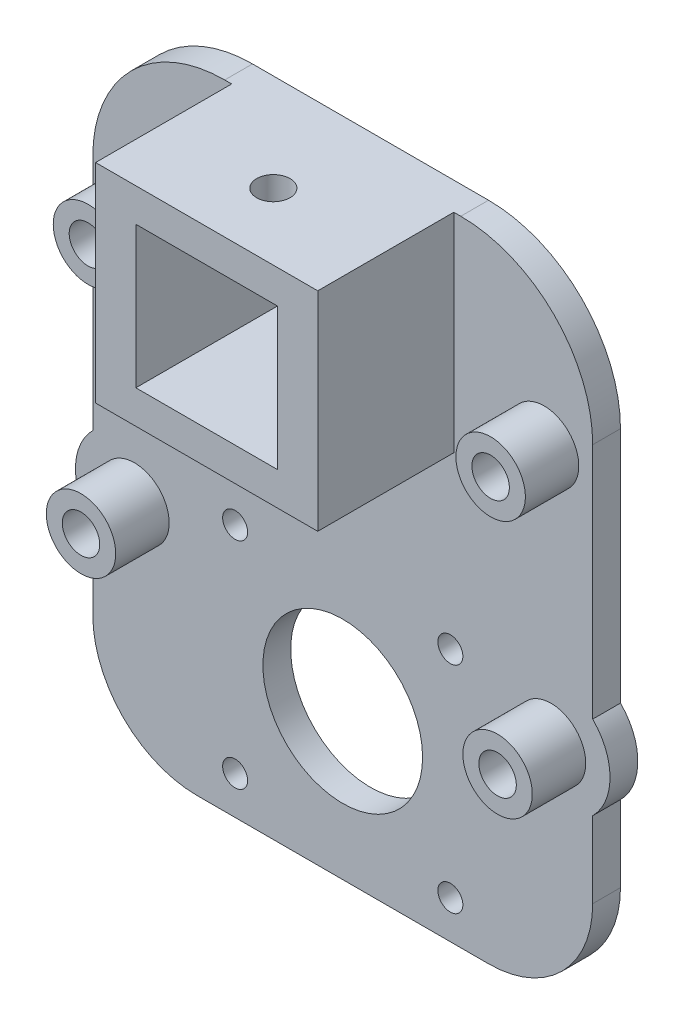
from build123d import *

# Parameters (mm, degrees)
SKETCH_1_R          = 1.8
SKETCH_1_R_2        = 11.5
SKETCH_1_R_3        = 2.7
SKETCH_1_W          = 20.4
SKETCH_1_H          = 20.4
EXTRUDE_1_DEPTH     = 4
EXTRUDE_START       = 4
SKETCH_1_4_W        = 32
SKETCH_1_4_H        = 30
SKETCH_1_4_W_2      = 20.4
SKETCH_1_4_H_2      = 20.4
SKETCH_1_4_R        = 1.6
EXTRUDE_3_DEPTH     = 19.6
CUT_EXTRUDE_4_REACH = 103.812
SKETCH_8_R          = 2.4
SKETCH_9_R          = 5
SKETCH_9_R_2        = 2.7
EXTRUDE_4_DEPTH     = 7.7


with BuildPart() as part:
    # 草图1 → 凸台-拉伸1 (new body)
    with BuildSketch(Plane.XY):
        with BuildLine():
            ThreePointArc((-36, -25.5), (-31.606601718, -36.106601718), (-21, -40.5))
            Line((-21, -40.5), (21, -40.5))
            ThreePointArc((21, -40.5), (31.606601718, -36.106601718), (36, -25.5))
            Line((36, -25.5), (36, -14.520797289))
            ThreePointArc((36, -14.520797289), (38.5, -8.5), (36, -2.479202711))
            Line((36, -2.479202711), (36, 31.75))
            ThreePointArc((36, 31.75), (30.435028843, 45.185028843), (17, 50.75))
            Line((17, 50.75), (-17, 50.75))
            ThreePointArc((-17, 50.75), (-30.435028843, 45.185028843), (-36, 31.75))
            Line((-36, 31.75), (-36, -2.479202711))
            ThreePointArc((-36, -2.479202711), (-38.5, -8.5), (-36, -14.520797289))
            Line((-36, -14.520797289), (-36, -25.5))
        make_face()
        with Locations((15.5, -35)):
            Circle(SKETCH_1_R, mode=Mode.SUBTRACT)
        with Locations((0, -19.5)):
            Circle(SKETCH_1_R_2, mode=Mode.SUBTRACT)
        with Locations((15.5, -4)):
            Circle(SKETCH_1_R, mode=Mode.SUBTRACT)
        with Locations((-15.5, -35)):
            Circle(SKETCH_1_R, mode=Mode.SUBTRACT)
        with Locations((-15.5, -4)):
            Circle(SKETCH_1_R, mode=Mode.SUBTRACT)
        with Locations((-30, -8.5)):
            Circle(SKETCH_1_R_3, mode=Mode.SUBTRACT)
        with Locations((30, -8.5)):
            Circle(SKETCH_1_R_3, mode=Mode.SUBTRACT)
        with Locations((-29, 28.1)):
            Circle(SKETCH_1_R_3, mode=Mode.SUBTRACT)
        with Locations((29, 28.1)):
            Circle(SKETCH_1_R_3, mode=Mode.SUBTRACT)
        with Locations((0, 35.75)):
            Rectangle(SKETCH_1_W, SKETCH_1_H, mode=Mode.SUBTRACT)
    extrude(amount=EXTRUDE_1_DEPTH)

    # 草图1<4> → 凸台-拉伸3 (add)
    # profile 1 of 3: a face of its own
    with BuildSketch(Plane.XY.offset(EXTRUDE_START)):
        with Locations((0, 35.75)):
            Rectangle(SKETCH_1_4_W, SKETCH_1_4_H)
        with Locations((0, 35.75)):
            Rectangle(SKETCH_1_4_W_2, SKETCH_1_4_H_2, mode=Mode.SUBTRACT)
    # profile 2 of 3: a face of its own
    with BuildSketch(Plane.XY.offset(EXTRUDE_START)):
        with Locations((-13.2, 35.75)):
            Circle(SKETCH_1_4_R)
    # profile 3 of 3: a face of its own
    with BuildSketch(Plane.XY.offset(EXTRUDE_START)):
        with Locations((13.2, 35.75)):
            Circle(SKETCH_1_4_R)
    extrude(amount=EXTRUDE_3_DEPTH)

    # 草图8 → 切除-拉伸4 (cut, up to next)
    with BuildSketch(Plane(origin=(0, 50.75, 0), x_dir=(1, 0, 0), z_dir=(0, 1, 0)), mode=Mode.PRIVATE) as cut_extrude_4_sk1:
        with Locations(Location((0, -14, 0), (0, 0, 270))):
            Circle(SKETCH_8_R)
    cut_extrude_4_tool1 = extrude(cut_extrude_4_sk1.sketch, amount=-CUT_EXTRUDE_4_REACH, mode=Mode.PRIVATE) & part.part
    add(cut_extrude_4_tool1.solids().sort_by_distance((0, 50.75, 14))[0], mode=Mode.SUBTRACT)

    # 草图9 → 凸台-拉伸4 (add)
    # profile 1 of 4: a face of its own
    with BuildSketch(Plane.XY.offset(4)):
        with Locations(Location((-29, 28.1, 0), (0, 0, 180))):
            Circle(SKETCH_9_R)
        with Locations((-29, 28.1)):
            Circle(SKETCH_9_R_2, mode=Mode.SUBTRACT)
    # profile 2 of 4: a face of its own
    with BuildSketch(Plane.XY.offset(4)):
        with Locations(Location((-30, -8.5, 0), (0, 0, 180))):
            Circle(SKETCH_9_R)
        with Locations((-30, -8.5)):
            Circle(SKETCH_9_R_2, mode=Mode.SUBTRACT)
    # profile 3 of 4: a face of its own
    with BuildSketch(Plane.XY.offset(4)):
        with Locations(Location((30, -8.5, 0), (0, 0, 180))):
            Circle(SKETCH_9_R)
        with Locations(Location((30, -8.5, 0), (0, 0, 180))):
            Circle(SKETCH_9_R_2, mode=Mode.SUBTRACT)
    # profile 4 of 4: a face of its own
    with BuildSketch(Plane.XY.offset(4)):
        with Locations(Location((29, 28.1, 0), (0, 0, 180))):
            Circle(SKETCH_9_R)
        with Locations(Location((29, 28.1, 0), (0, 0, 180))):
            Circle(SKETCH_9_R_2, mode=Mode.SUBTRACT)
    extrude(amount=EXTRUDE_4_DEPTH)


solid = part.part
